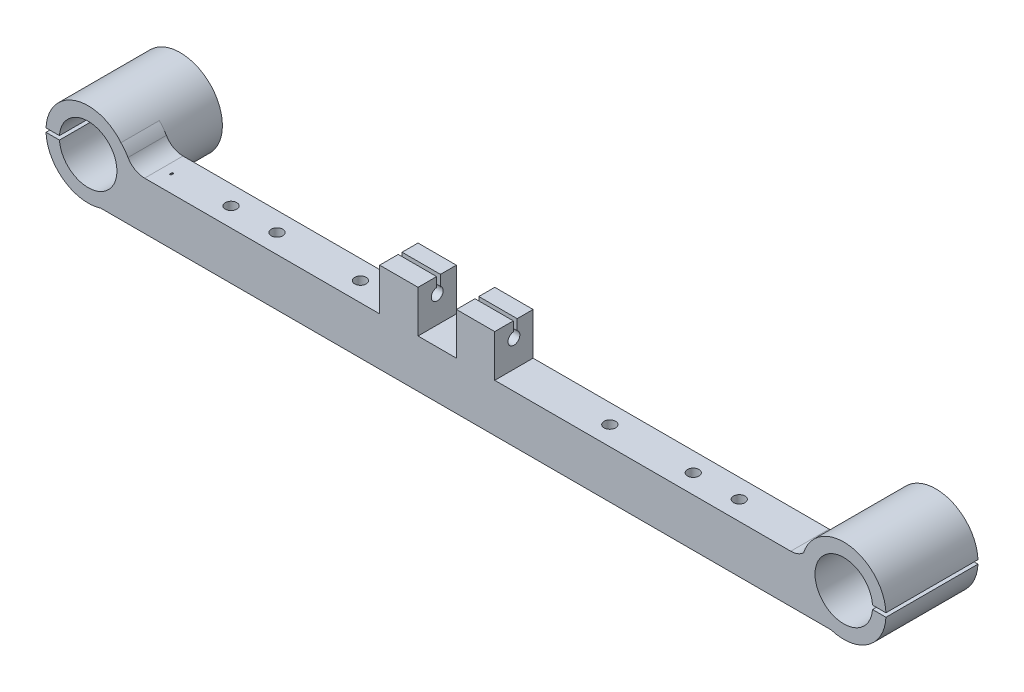
from build123d import *
from build123d.topology import SkipClean

# Parameters (mm, degrees)
SKETCH2_R           = 7.5
BOSS_EXTRUDE1_DEPTH = 10
FILLET1_R           = 5
BOSS_EXTRUDE2_START = -24
SKETCH3_R           = 11
SKETCH3_R_2         = 7.5
BOSS_EXTRUDE2_DEPTH = 24
CUT_EXTRUDE1_REACH  = 135.566
SKETCH4_R           = 1.55
SKETCH6_W           = 37.11251069
SKETCH6_H           = 1
CUT_EXTRUDE3_DEPTH  = 10
SKETCH7_W           = 36.737317401
SKETCH7_H           = 1
CUT_EXTRUDE4_DEPTH  = 3
FILLET2_R           = 5
SKETCH9_W           = 0.416349778
SKETCH9_H           = 0.714723325
CUT_EXTRUDE6_DEPTH  = 1
SKETCH8_R           = 1.5
CUT_EXTRUDE5_DEPTH  = 7


with BuildPart() as part:
    # Sketch2 → Boss-Extrude1 (new body)
    with BuildSketch(Plane.XY):
        with BuildLine():
            Line((-22.5, 3.831552556), (-22.5, 14.831552556))
            Line((-22.5, 14.831552556), (-12.5, 14.831552556))
            Line((-12.5, 14.831552556), (-12.5, 3.831552556))
            Line((-12.5, 3.831552556), (-2.5, 3.831552556))
            Line((-2.5, 3.831552556), (-2.5, 14.831552556))
            Line((-2.5, 14.831552556), (7.5, 14.831552556))
            Line((7.5, 14.831552556), (7.5, 3.831552556))
            Line((7.5, 3.831552556), (88.192235936, 3.831552556))
            ThreePointArc((88.192235936, 3.831552556), (91.819805392, 9.932478429), (98.5, 12.331552556))
            ThreePointArc((98.5, 12.331552556), (109, 1.831552556), (98.5, -8.668447444))
            Line((98.5, -8.668447444), (-98.5, -8.668447444))
            ThreePointArc((-98.5, -8.668447444), (-109, 1.831552556), (-98.5, 12.331552556))
            ThreePointArc((-98.5, 12.331552556), (-91.358571571, 9.975203317), (-87.021759717, 3.831552556))
            Line((-87.021759717, 3.831552556), (-22.5, 3.831552556))
        make_face()
        with Locations((-98.5, 1.831552556)):
            Circle(SKETCH2_R, mode=Mode.SUBTRACT)
        with Locations((98.5, 1.831552556)):
            Circle(SKETCH2_R, mode=Mode.SUBTRACT)
    extrude(amount=BOSS_EXTRUDE1_DEPTH)

    # Fillet1
    fillet1_edges = [part.edges().sort_by_distance(p)[0] for p in [
        (88.192235936, 3.831552556, 5),
    ]]
    fillet(fillet1_edges, radius=FILLET1_R)

    # Sketch3 → Boss-Extrude2 (add)
    with BuildSketch(Plane.XY.offset(10).offset(BOSS_EXTRUDE2_START)):
        with Locations((-98.5, 1.831552556)):
            Circle(SKETCH3_R)
        with Locations((-98.5, 1.831552556)):
            Circle(SKETCH3_R_2, mode=Mode.SUBTRACT)
    boss_extrude2 = extrude(amount=BOSS_EXTRUDE2_DEPTH)

    # Mirror1: Boss-Extrude2 across plane
    with SkipClean():  # the faces are left unmerged after this step: merging them gives an invalid solid
        add(boss_extrude2.mirror(Plane(origin=(0, 0, 0), x_dir=(0, 0, 1), z_dir=(1, 0, 0))))

    # Cut-Extrude1: up to this face of the body (flat: up to its plane)
    cut_extrude1_end = Plane(part.part.faces().sort_by_distance((7.5, 9.331552556, 5))[0])
    # Sketch4 → Cut-Extrude1 (cut, up to the picked face)
    with BuildSketch(Plane.ZY.offset(22.5), mode=Mode.PRIVATE) as cut_extrude1_sk1:
        with Locations((5, 10.805752832)):
            Circle(SKETCH4_R)
    cut_extrude1_tool1 = split(extrude(cut_extrude1_sk1.sketch, amount=-CUT_EXTRUDE1_REACH, mode=Mode.PRIVATE), bisect_by=cut_extrude1_end, keep=Keep.BOTH, mode=Mode.PRIVATE)
    add(cut_extrude1_tool1.solids().sort_by(Axis((-22.5, 10.805753, 5), (1, 0, 0)))[0], mode=Mode.SUBTRACT)

    # Sketch6 → Cut-Extrude3 (cut)
    with BuildSketch(Plane(origin=(110, 0, 0), x_dir=(0, 0, -1), z_dir=(1, 0, 0))):
        with Locations((1.381927251, 1.831552556)):
            Rectangle(SKETCH6_W, SKETCH6_H)
    cut_extrude3 = extrude(amount=-CUT_EXTRUDE3_DEPTH, mode=Mode.SUBTRACT)

    # Mirror2: Cut-Extrude3 across plane
    add(cut_extrude3.mirror(Plane(origin=(0, 0, 0), x_dir=(0, 0, 1), z_dir=(1, 0, 0))), mode=Mode.SUBTRACT)

    # Sketch7 → Cut-Extrude4 (cut)
    with BuildSketch(Plane(origin=(0, 14.831552556, 0), x_dir=(1, 0, 0), z_dir=(0, 1, 0))):
        with Locations((-7.879171978, -4.654369626)):
            Rectangle(SKETCH7_W, SKETCH7_H)
    extrude(amount=-CUT_EXTRUDE4_DEPTH, mode=Mode.SUBTRACT)

    # Fillet2
    fillet2_edges = [part.edges().sort_by_distance(p)[0] for p in [
        (-87.021759717, 3.831552556, 5),
    ]]
    fillet(fillet2_edges, radius=FILLET2_R)

    # Sketch9 → Cut-Extrude6 (cut)
    with BuildSketch(Plane(origin=(0, 3.831552556, 0), x_dir=(1, 0, 0), z_dir=(0, 1, 0))):
        with Locations((-81.24394575, -5.497333598)):
            Rectangle(SKETCH9_W, SKETCH9_H)
    extrude(amount=-CUT_EXTRUDE6_DEPTH, mode=Mode.SUBTRACT)

    # Sketch8 → Cut-Extrude5 (cut)
    with BuildSketch(Plane(origin=(0, 3.831552556, 0), x_dir=(1, 0, 0), z_dir=(0, 1, 0))):
        with Locations(Location((-66.24976189, -5, 0), (0, 0, 270))):
            Circle(SKETCH8_R)
        with Locations(Location((-54.24976189, -5, 0), (0, 0, 270))):
            Circle(SKETCH8_R)
        with Locations(Location((-32.502764064, -5, 0), (0, 0, 270))):
            Circle(SKETCH8_R)
        with Locations(Location((32.497235936, -5, 0), (0, 0, 270))):
            Circle(SKETCH8_R)
        with Locations(Location((54.25023811, -5, 0), (0, 0, 270))):
            Circle(SKETCH8_R)
        with Locations(Location((66.25023811, -5, 0), (0, 0, 270))):
            Circle(SKETCH8_R)
    extrude(amount=-CUT_EXTRUDE5_DEPTH, mode=Mode.SUBTRACT)


solid = part.part
